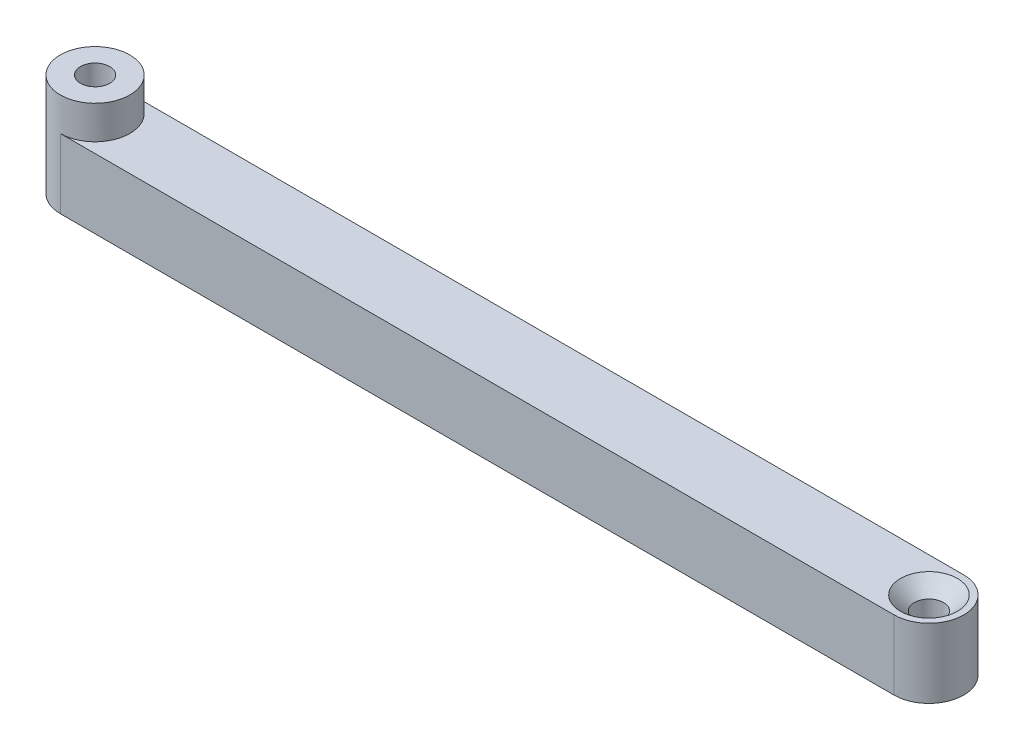
from build123d import *

# Parameters (mm, degrees)
SKETCH1_R           = 1.05
BOSS_EXTRUDE1_DEPTH = 5
CHAMFER1_SIZE       = 1
CHAMFER2_SIZE       = 1
SKETCH2_R           = 2.5
SKETCH2_R_2         = 1.05
BOSS_EXTRUDE2_DEPTH = 2.4


with BuildPart() as part:
    # Sketch1 → Boss-Extrude1 (new body)
    with BuildSketch(Plane(origin=(0, 0, 0), x_dir=(1, 0, 0), z_dir=(0, 1, 0))):
        with BuildLine():
            Line((0, 2.5), (60, 2.5))
            ThreePointArc((60, 2.5), (62.5, 0), (60, -2.5))
            Line((60, -2.5), (0, -2.5))
            ThreePointArc((0, -2.5), (-2.5, 0), (0, 2.5))
        make_face()
        with Locations(Location((0, 0, 0), (0, 0, 270))):
            Circle(SKETCH1_R, mode=Mode.SUBTRACT)
        with Locations(Location((60, 0, 0), (0, 0, 270))):
            Circle(SKETCH1_R, mode=Mode.SUBTRACT)
    extrude(amount=BOSS_EXTRUDE1_DEPTH)

    # Chamfer1
    chamfer1_edges = [part.edges().sort_by_distance(p)[0] for p in [
        (60, 5, -1.05),
    ]]
    chamfer(chamfer1_edges, length=CHAMFER1_SIZE)

    # Chamfer2
    chamfer2_edges = [part.edges().sort_by_distance(p)[0] for p in [
        (0, 0, -1.05),
    ]]
    chamfer(chamfer2_edges, length=CHAMFER2_SIZE)

    # Sketch2 → Boss-Extrude2 (add)
    with BuildSketch(Plane(origin=(0, 5, 0), x_dir=(1, 0, 0), z_dir=(0, 1, 0))):
        with Locations(Location((0, 0, 0), (0, 0, 270))):
            Circle(SKETCH2_R)
        with Locations(Location((0, 0, 0), (0, 0, 270))):
            Circle(SKETCH2_R_2, mode=Mode.SUBTRACT)
    extrude(amount=BOSS_EXTRUDE2_DEPTH)


solid = part.part
